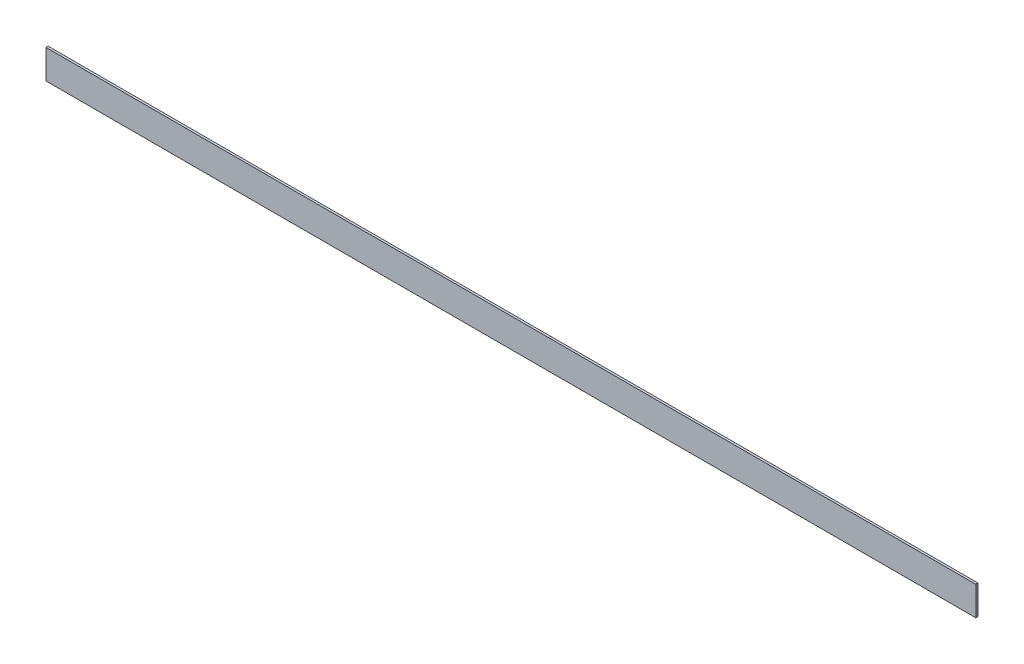
from build123d import *

# Parameters (mm, degrees)
TOPPING_PANEL_UST_SERIT_1_START = 38.5
SKETCH1_W                       = 640
SKETCH1_H                       = 20
TOPPING_PANEL_UST_SERIT_1_DEPTH = 1.5


with BuildPart() as part:
    # Sketch1 → TOPPING_panel_ust_serit_1 (new body)
    with BuildSketch(Plane.XY.offset(TOPPING_PANEL_UST_SERIT_1_START)):
        with Locations((350, 1960)):
            Rectangle(SKETCH1_W, SKETCH1_H)
    extrude(amount=TOPPING_PANEL_UST_SERIT_1_DEPTH)


solid = part.part
